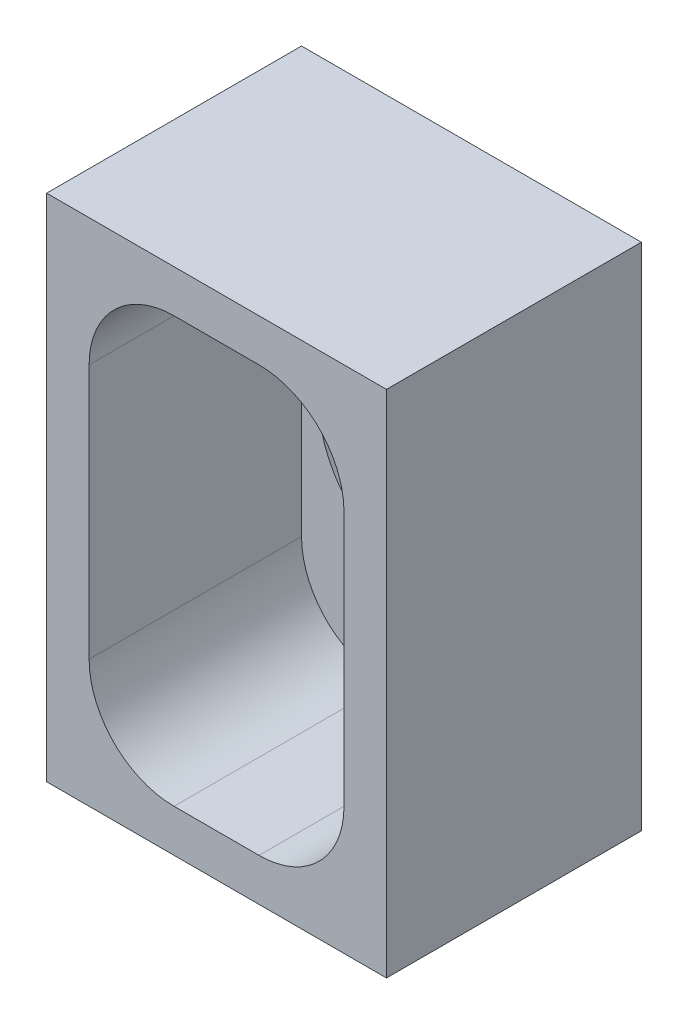
from build123d import *

# Parameters (mm, degrees)
SKETCH_1_W          = 40
SKETCH_1_H          = 50
SKETCH_1_R          = 1.6
SKETCH_1_R_2        = 3.25
EXTRUDE_1_DEPTH     = 5
SKETCH_2_R          = 13
CUT_EXTRUDE_1_DEPTH = 2.5
SKETCH_3_W          = 40
SKETCH_3_H          = 5
EXTRUDE_2_DEPTH     = 30
SKETCH_4_W          = 25
SKETCH_4_H          = 50
EXTRUDE_3_DEPTH     = 5
FILLET_1_R          = 10


with BuildPart() as part:
    # ｽｹｯﾁ1 → ﾎﾞｽ - 押し出し1 (new body)
    with BuildSketch(Plane.XY):
        Rectangle(SKETCH_1_W, SKETCH_1_H)
        with Locations((0, 8.5)):
            Circle(SKETCH_1_R, mode=Mode.SUBTRACT)
        with Locations((8.5, 0)):
            Circle(SKETCH_1_R, mode=Mode.SUBTRACT)
        with Locations((0, -8.5)):
            Circle(SKETCH_1_R, mode=Mode.SUBTRACT)
        with Locations((-8.5, 0)):
            Circle(SKETCH_1_R, mode=Mode.SUBTRACT)
        Circle(SKETCH_1_R_2, mode=Mode.SUBTRACT)
    extrude(amount=EXTRUDE_1_DEPTH)

    # ｽｹｯﾁ2 → ｶｯﾄ - 押し出し1 (cut)
    with BuildSketch(Plane.XY.offset(5)):
        Circle(SKETCH_2_R)
    extrude(amount=-CUT_EXTRUDE_1_DEPTH, mode=Mode.SUBTRACT)

    # ｽｹｯﾁ3 → ﾎﾞｽ - 押し出し2 (add)
    with BuildSketch(Plane(origin=(0, 0, 0), x_dir=(-1, 0, 0), z_dir=(0, 0, -1))):
        with Locations((0, 27.5)):
            Rectangle(SKETCH_3_W, SKETCH_3_H)
        with Locations((0, -27.5)):
            Rectangle(SKETCH_3_W, SKETCH_3_H)
    extrude(amount=-EXTRUDE_2_DEPTH)

    # ｽｹｯﾁ4 → ﾎﾞｽ - 押し出し3 (add)
    with BuildSketch(Plane(origin=(20, 0, 0), x_dir=(0, 0, -1), z_dir=(1, 0, 0))):
        with Locations((-17.5, 0)):
            Rectangle(SKETCH_4_W, SKETCH_4_H)
    extrude_3 = extrude(amount=-EXTRUDE_3_DEPTH)

    # ﾐﾗｰ1: ﾎﾞｽ - 押し出し3 across plane
    add(extrude_3.mirror(Plane(origin=(0, 0, 0), x_dir=(0, 0, 1), z_dir=(1, 0, 0))))

    # ﾌｨﾚｯﾄ1
    fillet_1_edges = [part.edges().sort_by_distance(p)[0] for p in [
        (15, -25, 17.5),
        (15, 25, 17.5),
        (-15, 25, 17.5),
        (-15, -25, 17.5),
    ]]
    fillet(fillet_1_edges, radius=FILLET_1_R)


solid = part.part
